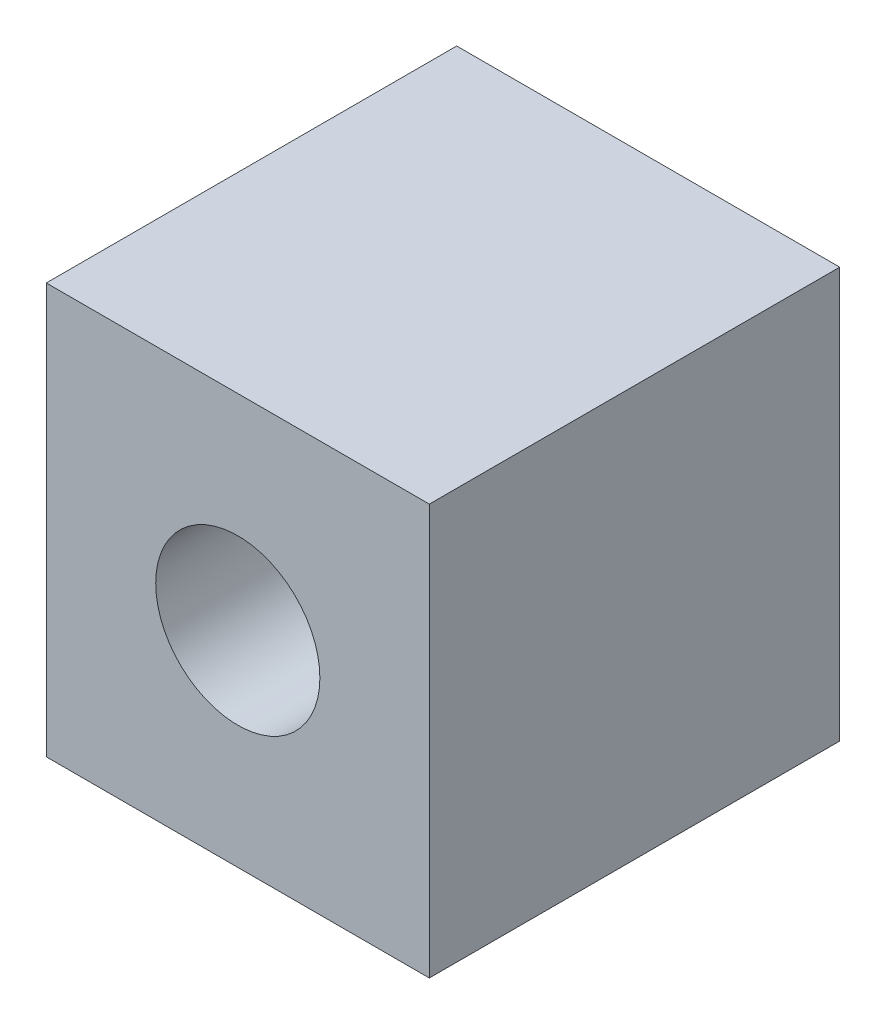
from build123d import *

# Parameters (mm, degrees)
BOSS_EXTRUDE1_DEPTH = 30
SKETCH2_R           = 6
CUT_EXTRUDE1_DEPTH  = 45.676615807


with BuildPart() as part:
    # Sketch1 → Boss-Extrude1 (new body)
    with BuildSketch(Plane(origin=(0, 0, 0), x_dir=(1, 0, 0), z_dir=(0, 1, 0))):
        Polygon((-14, 0), (-14, -15), (14, -15), (14, 15), (-14, 15), align=None)
    extrude(amount=BOSS_EXTRUDE1_DEPTH)

    # Sketch2 → Cut-Extrude1 (cut, through all)
    with BuildSketch(Plane.XY.offset(15)):
        with Locations((0, 15)):
            Circle(SKETCH2_R)
    extrude(amount=-CUT_EXTRUDE1_DEPTH, mode=Mode.SUBTRACT)


solid = part.part
